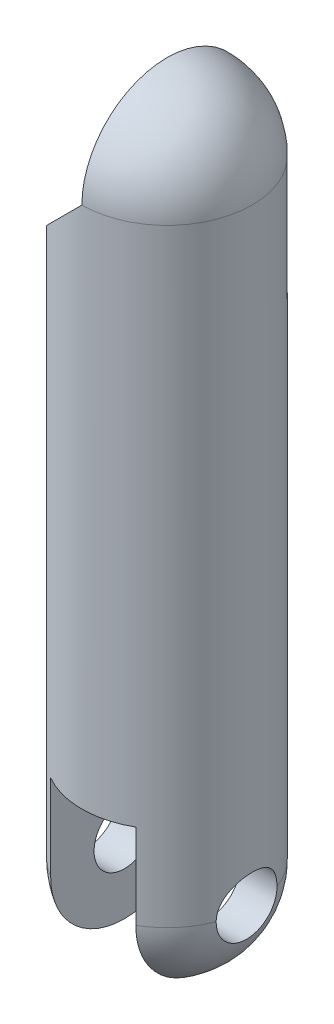
from build123d import *
from build123d.topology import SkipClean

# Parameters (mm, degrees)
SKETCH2_R               = 70.00000000000001
BOSS_EXTRUDE1_DEPTH     = 500
SKETCH5_R               = 70.00000000000003
CUT_EXTRUDE1_DEPTH      = 500
CUT_EXTRUDE2_DEPTH      = 70
CUT_EXTRUDE2_DEPTH_BACK = 100
SKETCH6_W               = 70
SKETCH6_H               = 140
CUT_EXTRUDE3_DEPTH      = 120
CUT_EXTRUDE3_DEPTH_BACK = 100
SKETCH7_R               = 25
SKETCH8_R               = 25.000000000000007
CUT_EXTRUDE4_DEPTH      = 50


with BuildPart() as part:
    # Sketch2 → Boss-Extrude1 (new body)
    with BuildSketch(Plane(origin=(0, 0, 0), x_dir=(1, 0, 0), z_dir=(0, 1, 0))):
        with Locations(Location((0, 0, 0), (0, 0, 270))):
            Circle(SKETCH2_R)
    extrude(amount=BOSS_EXTRUDE1_DEPTH)

    # Sketch3 one side → Revolve1 (revolve)
    with SkipClean():  # the faces are left unmerged after this step: merging them gives an invalid solid
        with BuildSketch(Plane(origin=(0, 0, 0), x_dir=(-1, 0, 0), z_dir=(0, -1, 0))):
            with BuildLine():
                ThreePointArc((-1.505e-12, -70.00000000000001), (49.497474683057796, -49.49747468305888), (70.00000000000001, -2.07e-14))
                ThreePointArc((70.00000000000001, -3.55e-15), (49.497474683058854, 49.49747468305782), (1.46534e-12, 70.00000000000001))
                Line((0, 70.00000000000001), (0, -70.00000000000001))
            make_face()
        revolve(axis=Axis((0, 0, 0), (0, 0, 1)))

    # Sketch4 → Revolve2 (revolve)
    with SkipClean():  # the faces are left unmerged after this step: merging them gives an invalid solid
        with BuildSketch(Plane(origin=(0, 500, 0), x_dir=(1, 0, 0), z_dir=(0, 1, 0))):
            with BuildLine():
                Line((0, 70.00000000000001), (0, -70.00000000000001))
                ThreePointArc((0, -70.00000000000001), (70.00000000000001, 0), (0, 70.00000000000001))
            make_face()
        revolve(axis=Axis((0, 500, -70.00000000000001), (0, 0, 1)))

    # Sketch5 → Cut-Extrude1 (cut)
    with SkipClean():  # the faces are left unmerged after this step: merging them gives an invalid solid
        with BuildSketch(Plane(origin=(0, 0, 0), x_dir=(0, 0, -1), z_dir=(1, 0, 0))):
            with Locations((0, 500)):
                Circle(SKETCH5_R)
        extrude(amount=-CUT_EXTRUDE1_DEPTH, mode=Mode.SUBTRACT)

    # Sketch6 → Cut-Extrude2 (cut, two sides: drawn at the far end of the back side and taken through both)
    with BuildSketch(Plane(origin=(0, 0, 0), x_dir=(1, 0, 0), z_dir=(0, 1, 0)).offset(-CUT_EXTRUDE2_DEPTH_BACK)):
        Rectangle(SKETCH6_W, SKETCH6_H)
    extrude(amount=CUT_EXTRUDE2_DEPTH + CUT_EXTRUDE2_DEPTH_BACK, mode=Mode.SUBTRACT)

    # Sketch7 → Cut-Extrude3 (cut, two sides: drawn at the far end of the back side and taken through both)
    with BuildSketch(Plane.ZY.offset(-35).offset(-CUT_EXTRUDE3_DEPTH_BACK)):
        with Locations(Location((0, 0, 0), (0, 0, 180))):
            Circle(SKETCH7_R)
    extrude(amount=CUT_EXTRUDE3_DEPTH + CUT_EXTRUDE3_DEPTH_BACK, mode=Mode.SUBTRACT)

    # Sketch8 → Cut-Extrude4 (cut)
    with BuildSketch(Plane.ZY):
        with Locations((0, 500)):
            Circle(SKETCH8_R)
    extrude(amount=-CUT_EXTRUDE4_DEPTH, mode=Mode.SUBTRACT)


solid = part.part
